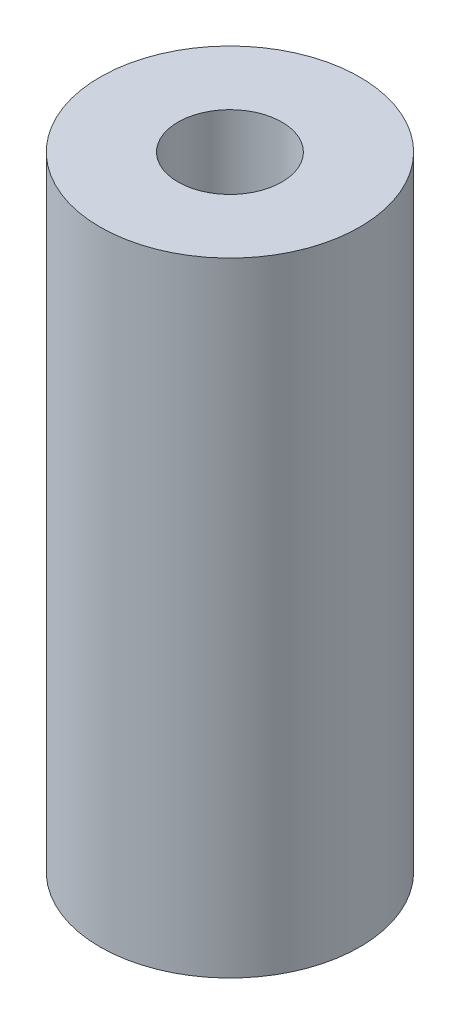
from build123d import *

# Parameters (mm, degrees)
SKETCH3_R           = 3
SKETCH3_R_2         = 1
BOSS_EXTRUDE1_DEPTH = 5


with BuildPart() as part:
    # Sketch2 → Revolve1 (revolve)
    with BuildSketch(Plane.XY, mode=Mode.PRIVATE) as revolve1_sk:
        Polygon((3, 0), (3, 18), (2, 18), (2, 24), (5, 24), (5, 0), align=None)
    revolve(revolve1_sk.sketch.rotate(Axis((0, 10.839741494, 0), (0, -1, 0)), 90), axis=Axis((0, 10.839741494, 0), (0, -1, 0)))

    # Sketch3 → Boss-Extrude1 (add)
    with BuildSketch(Plane.XZ.offset(-18)):
        with Locations(Location((0, 0, 0), (0, 0, 90))):
            Circle(SKETCH3_R)
        with Locations(Location((0, 0, 0), (0, 0, 270))):
            Circle(SKETCH3_R_2, mode=Mode.SUBTRACT)
    extrude(amount=BOSS_EXTRUDE1_DEPTH)


solid = part.part
